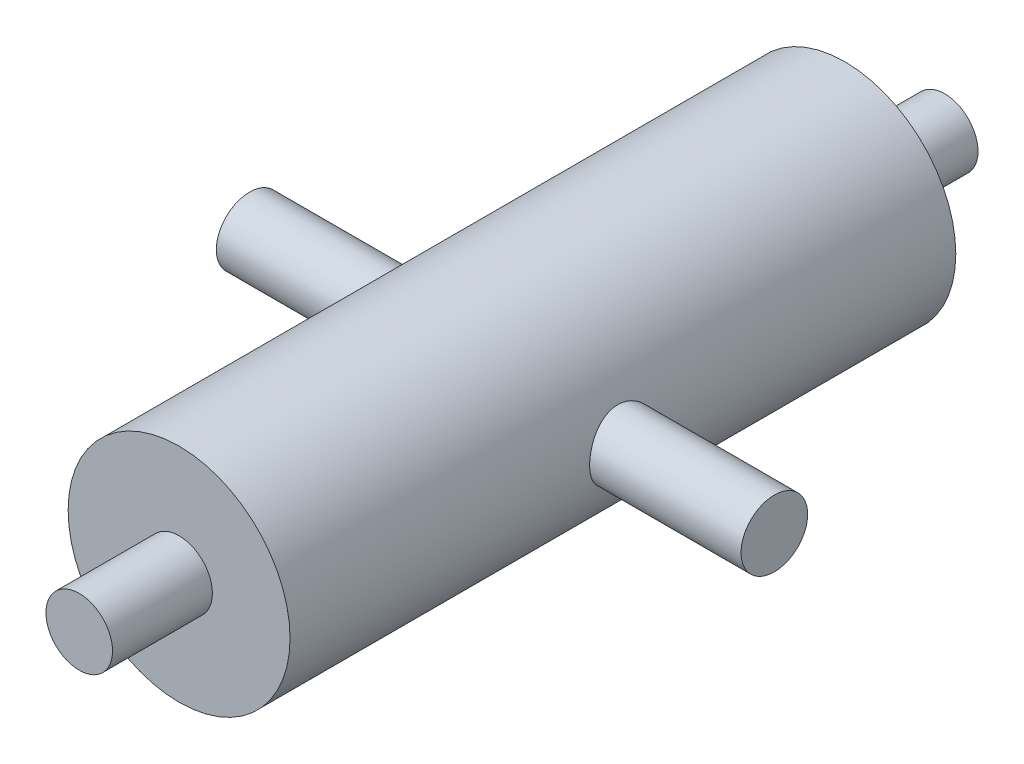
from build123d import *

# Parameters (mm, degrees)
SKETCH1_R                = 10
BOSS_EXTRUDE1_DEPTH      = 60
SKETCH2_R                = 3
BOSS_EXTRUDE2_DEPTH      = 23.645
BOSS_EXTRUDE3_DEPTH      = 9
BOSS_EXTRUDE3_DEPTH_BACK = 69
SKETCH3_R                = 3


with BuildPart() as part:
    # Sketch1 → Boss-Extrude1 (new body)
    with BuildSketch(Plane.XY):
        Circle(SKETCH1_R)
    extrude(amount=BOSS_EXTRUDE1_DEPTH)

    # Sketch2 → Boss-Extrude2 (add, symmetric)
    with BuildSketch(Plane(origin=(0, 0, 0), x_dir=(0, 0, -1), z_dir=(1, 0, 0))):
        with Locations((-30, 0)):
            Circle(SKETCH2_R)
    extrude(amount=BOSS_EXTRUDE2_DEPTH, both=True)

    # Sketch3 → Boss-Extrude3 (add, two sides: drawn at the far end of the back side and taken through both)
    with BuildSketch(Plane.XY.offset(60).offset(-BOSS_EXTRUDE3_DEPTH_BACK)):
        Circle(SKETCH3_R)
    extrude(amount=BOSS_EXTRUDE3_DEPTH + BOSS_EXTRUDE3_DEPTH_BACK)


solid = part.part
